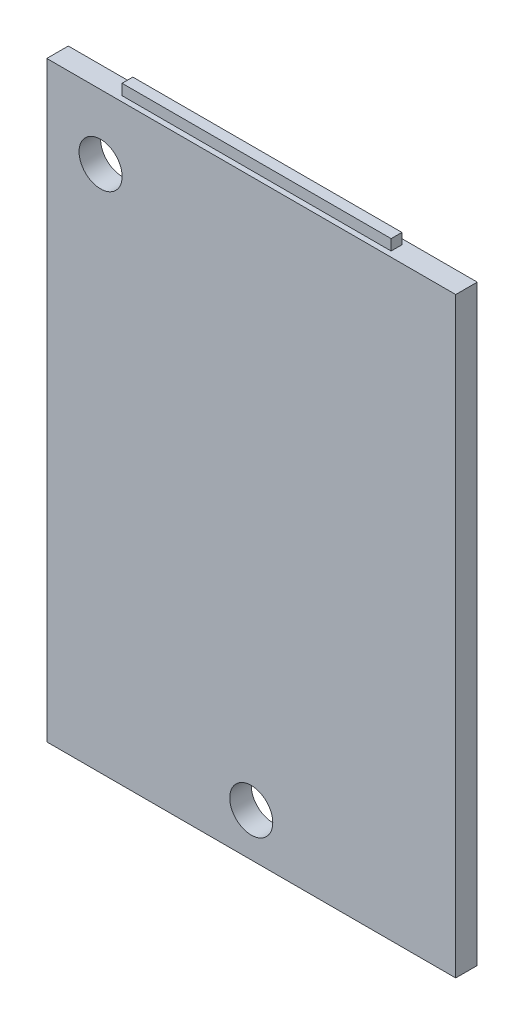
from build123d import *

# Parameters (mm, degrees)
SKETCH1_W           = 190
SKETCH1_H           = 275
BOSS_EXTRUDE1_DEPTH = 10
SKETCH2_W           = 125
SKETCH2_H           = 5
BOSS_EXTRUDE2_DEPTH = 5
SKETCH3_R           = 10
CUT_EXTRUDE1_DEPTH  = 16


with BuildPart() as part:
    # Sketch1 → Boss-Extrude1 (new body)
    with BuildSketch(Plane.XY):
        Rectangle(SKETCH1_W, SKETCH1_H)
    extrude(amount=BOSS_EXTRUDE1_DEPTH)

    # Sketch2 → Boss-Extrude2 (add)
    with BuildSketch(Plane(origin=(0, 137.5, 0), x_dir=(1, 0, 0), z_dir=(0, 1, 0))):
        with Locations((0, -5)):
            Rectangle(SKETCH2_W, SKETCH2_H)
    extrude(amount=BOSS_EXTRUDE2_DEPTH)

    # Sketch3 → Cut-Extrude1 (cut)
    with BuildSketch(Plane.XY.offset(10)):
        with Locations((0, -117.5)):
            Circle(SKETCH3_R)
        with Locations((-70, 107.5)):
            Circle(SKETCH3_R)
    extrude(amount=-CUT_EXTRUDE1_DEPTH, mode=Mode.SUBTRACT)


solid = part.part
